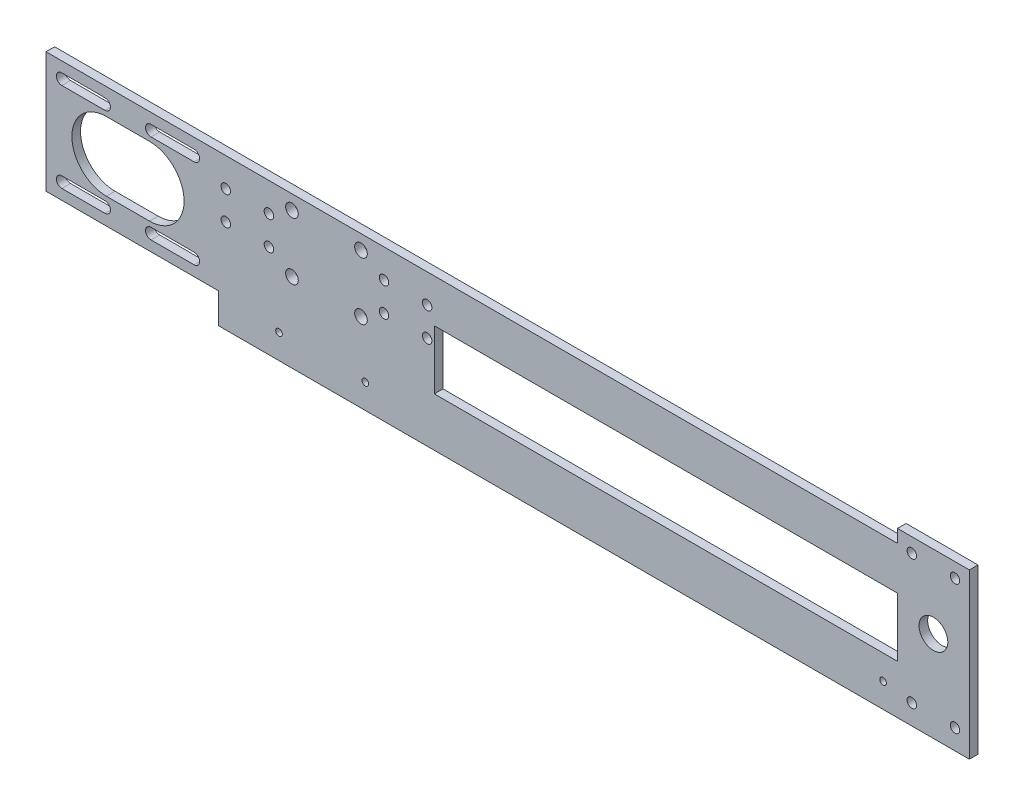
from build123d import *

# Parameters (mm, degrees)
SKETCH_1_W          = 75
SKETCH_1_H          = 30
EXTRUDE_1_DEPTH     = 3
HOLE_WIZARD_1_D     = 4.4
HOLE_WIZARD_2_D     = 3.3
SKETCH_8_W          = 45
SKETCH_8_H          = 42
EXTRUDE_2_DEPTH     = 3
HOLE_WIZARD_3_D     = 3.8
SKETCH_13_W         = 15
SKETCH_13_H         = 42
EXTRUDE_3_DEPTH     = 3
CUT_EXTRUDE_3_DEPTH = 3
CUT_EXTRUDE_5_DEPTH = 3
CUT_EXTRUDE_6_DEPTH = 3
SKETCH_18_W         = 75
SKETCH_18_H         = 2.504084813
SKETCH_18_H_2       = 3
SKETCH_18_W_2       = 161
SKETCH_18_H_3       = 17
EXTRUDE_4_DEPTH     = 3
HOLE_WIZARD_4_D     = 2.3
SKETCH_22_W         = 25
SKETCH_22_H         = 42
EXTRUDE_5_DEPTH     = 3
HOLE_WIZARD_5_D     = 10
HOLE_WIZARD_5_DEPTH = 3
HOLE_WIZARD_7_D     = 3.3
HOLE_WIZARD_7_DEPTH = 3.001
SKETCH_31_W         = 25
SKETCH_31_H         = 15
EXTRUDE_6_DEPTH     = 3
HOLE_WIZARD_8_D     = 3.3
HOLE_WIZARD_8_DEPTH = 3
SKETCH_36_W         = 161
SKETCH_36_H         = 15
EXTRUDE_7_DEPTH     = 3
HOLE_WIZARD_9_D     = 2.3
SKETCH_40_R         = 12
CUT_EXTRUDE_7_DEPTH = 10


with BuildPart() as part:
    # 草图1 → 凸台-拉伸1 (new body)
    with BuildSketch(Plane.XY):
        with Locations((37.5, 15)):
            Rectangle(SKETCH_1_W, SKETCH_1_H)
    extrude(amount=EXTRUDE_1_DEPTH)

    # 孔1 (through all)
    with Locations(Plane.XY.offset(3)):
        with Locations((25.5, 25), (49.5, 25), (49.5, 5), (25.5, 5)):
            Hole(HOLE_WIZARD_1_D / 2)

    # 孔2 (through all)
    with Locations(Plane.XY.offset(3)):
        with Locations((2.5, 20), (17.5, 20), (17.5, 10), (2.5, 10), (57.5, 10), (57.5, 20), (72.5, 20), (72.5, 10)):
            Hole(HOLE_WIZARD_2_D / 2)

    # 草图8 → 凸台-拉伸2 (add)
    with BuildSketch(Plane(origin=(0, 0, 0), x_dir=(-1, 0, 0), z_dir=(0, 0, -1))):
        with Locations((22.5, 9)):
            Rectangle(SKETCH_8_W, SKETCH_8_H)
    extrude(amount=-EXTRUDE_2_DEPTH)

    # 孔3 (through all)
    with Locations(Plane.XY.offset(3)):
        with Locations((-39.5, 24.5), (-8.5, 24.5), (-8.5, -6.5), (-39.5, -6.5)):
            Hole(HOLE_WIZARD_3_D / 2)

    # 草图13 → 凸台-拉伸3 (add)
    with BuildSketch(Plane(origin=(0, 0, 0), x_dir=(-1, 0, 0), z_dir=(0, 0, -1))):
        with Locations((52.5, 9)):
            Rectangle(SKETCH_13_W, SKETCH_13_H)
    extrude(amount=-EXTRUDE_3_DEPTH)

    # 草图14 → 切除-拉伸3 (cut)
    with BuildSketch(Plane(origin=(0, 0, 0), x_dir=(-1, 0, 0), z_dir=(0, 0, -1))):
        with BuildLine():
            Line((23.5, 26.4), (8.5, 26.4))
            ThreePointArc((8.5, 26.4), (9.843502884, 25.843502884), (10.4, 24.5))
            ThreePointArc((10.4, 24.5), (9.843502884, 23.156497116), (8.5, 22.6))
            Line((8.5, 22.6), (23.5, 22.6))
            ThreePointArc((23.5, 22.6), (21.6, 24.5), (23.5, 26.4))
        make_face()
        with BuildLine():
            ThreePointArc((25.4, 24.5), (24.843502884, 25.843502884), (23.5, 26.4))
            Line((23.5, 26.4), (23.5, 22.6))
            ThreePointArc((23.5, 22.6), (24.843502884, 23.156497116), (25.4, 24.5))
        make_face()
        with BuildLine():
            Line((23.5, 22.6), (23.5, 26.4))
            ThreePointArc((23.5, 26.4), (21.6, 24.5), (23.5, 22.6))
        make_face()
        with BuildLine():
            ThreePointArc((10.4, 24.5), (9.843502884, 25.843502884), (8.5, 26.4))
            Line((8.5, 26.4), (8.5, 22.6))
            ThreePointArc((8.5, 22.6), (9.843502884, 23.156497116), (10.4, 24.5))
        make_face()
        with BuildLine():
            Line((8.5, 22.6), (8.5, 26.4))
            ThreePointArc((8.5, 26.4), (6.6, 24.5), (8.5, 22.6))
        make_face()
        with BuildLine():
            Line((23.5, -4.6), (8.5, -4.6))
            ThreePointArc((8.5, -4.6), (9.843502884, -5.156497116), (10.4, -6.5))
            ThreePointArc((10.4, -6.5), (9.843502884, -7.843502884), (8.5, -8.4))
            Line((8.5, -8.4), (23.5, -8.4))
            ThreePointArc((23.5, -8.4), (21.6, -6.5), (23.5, -4.6))
        make_face()
        with BuildLine():
            ThreePointArc((10.4, -6.5), (9.843502884, -5.156497116), (8.5, -4.6))
            Line((8.5, -4.6), (8.5, -8.4))
            ThreePointArc((8.5, -8.4), (9.843502884, -7.843502884), (10.4, -6.5))
        make_face()
        with BuildLine():
            Line((8.5, -8.4), (8.5, -4.6))
            ThreePointArc((8.5, -4.6), (6.6, -6.5), (8.5, -8.4))
        make_face()
        with BuildLine():
            ThreePointArc((25.4, -6.5), (24.843502884, -5.156497116), (23.5, -4.6))
            Line((23.5, -4.6), (23.5, -8.4))
            ThreePointArc((23.5, -8.4), (24.843502884, -7.843502884), (25.4, -6.5))
        make_face()
        with BuildLine():
            Line((23.5, -8.4), (23.5, -4.6))
            ThreePointArc((23.5, -4.6), (21.6, -6.5), (23.5, -8.4))
        make_face()
        with BuildLine():
            ThreePointArc((39.5, 26.4), (40.843502884, 25.843502884), (41.4, 24.5))
            Line((41.4, 24.5), (52.6, 24.5))
            ThreePointArc((52.6, 24.5), (53.156497116, 25.843502884), (54.5, 26.4))
            Line((54.5, 26.4), (39.5, 26.4))
        make_face()
        with BuildLine():
            Line((52.6, 24.5), (41.4, 24.5))
            ThreePointArc((41.4, 24.5), (40.843502884, 23.156497116), (39.5, 22.6))
            Line((39.5, 22.6), (54.5, 22.6))
            ThreePointArc((54.5, 22.6), (53.156497116, 23.156497116), (52.6, 24.5))
        make_face()
        with BuildLine():
            Line((41.4, 24.5), (39.5, 24.5))
            Line((39.5, 24.5), (39.5, 22.6))
            ThreePointArc((39.5, 22.6), (40.843502884, 23.156497116), (41.4, 24.5))
        make_face()
        with BuildLine():
            Line((39.5, 26.4), (39.5, 24.5))
            Line((39.5, 24.5), (41.4, 24.5))
            ThreePointArc((41.4, 24.5), (40.843502884, 25.843502884), (39.5, 26.4))
        make_face()
        with BuildLine():
            Line((39.5, 22.6), (39.5, 24.5))
            Line((39.5, 24.5), (39.5, 26.4))
            ThreePointArc((39.5, 26.4), (37.6, 24.5), (39.5, 22.6))
        make_face()
        with BuildLine():
            Line((54.5, 24.5), (54.5, 22.6))
            ThreePointArc((54.5, 22.6), (55.843502884, 23.156497116), (56.4, 24.5))
            ThreePointArc((56.4, 24.5), (55.843502884, 25.843502884), (54.5, 26.4))
            Line((54.5, 26.4), (54.5, 24.5))
        make_face()
        with BuildLine():
            Line((54.5, 24.5), (52.6, 24.5))
            ThreePointArc((52.6, 24.5), (53.156497116, 23.156497116), (54.5, 22.6))
            Line((54.5, 22.6), (54.5, 24.5))
        make_face()
        with BuildLine():
            ThreePointArc((54.5, 26.4), (53.156497116, 25.843502884), (52.6, 24.5))
            Line((52.6, 24.5), (54.5, 24.5))
            Line((54.5, 24.5), (54.5, 26.4))
        make_face()
        with BuildLine():
            Line((54.5, -4.6), (39.5, -4.6))
            ThreePointArc((39.5, -4.6), (40.843502884, -5.156497116), (41.4, -6.5))
            Line((41.4, -6.5), (52.6, -6.5))
            ThreePointArc((52.6, -6.5), (53.156497116, -5.156497116), (54.5, -4.6))
        make_face()
        with BuildLine():
            Line((52.6, -6.5), (41.4, -6.5))
            ThreePointArc((41.4, -6.5), (40.843502884, -7.843502884), (39.5, -8.4))
            Line((39.5, -8.4), (54.5, -8.4))
            ThreePointArc((54.5, -8.4), (53.156497116, -7.843502884), (52.6, -6.5))
        make_face()
        with BuildLine():
            Line((54.5, -6.5), (54.5, -4.6))
            ThreePointArc((54.5, -4.6), (53.156497116, -5.156497116), (52.6, -6.5))
            Line((52.6, -6.5), (54.5, -6.5))
        make_face()
        with BuildLine():
            Line((54.5, -8.4), (54.5, -6.5))
            Line((54.5, -6.5), (52.6, -6.5))
            ThreePointArc((52.6, -6.5), (53.156497116, -7.843502884), (54.5, -8.4))
        make_face()
        with BuildLine():
            ThreePointArc((56.4, -6.5), (55.843502884, -5.156497116), (54.5, -4.6))
            Line((54.5, -4.6), (54.5, -6.5))
            Line((54.5, -6.5), (54.5, -8.4))
            ThreePointArc((54.5, -8.4), (55.843502884, -7.843502884), (56.4, -6.5))
        make_face()
        with BuildLine():
            ThreePointArc((41.4, -6.5), (40.843502884, -5.156497116), (39.5, -4.6))
            Line((39.5, -4.6), (39.5, -6.5))
            Line((39.5, -6.5), (41.4, -6.5))
        make_face()
        with BuildLine():
            Line((41.4, -6.5), (39.5, -6.5))
            Line((39.5, -6.5), (39.5, -8.4))
            ThreePointArc((39.5, -8.4), (40.843502884, -7.843502884), (41.4, -6.5))
        make_face()
        with BuildLine():
            Line((39.5, -6.5), (39.5, -4.6))
            ThreePointArc((39.5, -4.6), (37.6, -6.5), (39.5, -8.4))
            Line((39.5, -8.4), (39.5, -6.5))
        make_face()
    extrude(amount=-CUT_EXTRUDE_3_DEPTH, mode=Mode.SUBTRACT)

    # 草图16 → 切除-拉伸5 (cut)
    with BuildSketch(Plane(origin=(0, 0, 0), x_dir=(-1, 0, 0), z_dir=(0, 0, -1))):
        with BuildLine():
            Line((24, 20.504084813), (24, -2.489125293))
            Line((24, -2.489125293), (39.5, -2.489125293))
            ThreePointArc((39.5, -2.489125293), (50.5, 9), (39.5, 20.489125293))
            Line((39.5, 20.489125293), (39.5, 20.504084813))
            Line((39.5, 20.504084813), (24, 20.504084813))
        make_face()
    extrude(amount=-CUT_EXTRUDE_5_DEPTH, mode=Mode.SUBTRACT)

    # 草图17 → 切除-拉伸6 (cut)
    with BuildSketch(Plane(origin=(0, 0, 0), x_dir=(-1, 0, 0), z_dir=(0, 0, -1))):
        with BuildLine():
            Line((24, -2.489125293), (24, 20.504084813))
            ThreePointArc((24, 20.504084813), (12.495915187, 9), (24, -2.504084813))
            Line((24, -2.504084813), (24, -2.489125293))
        make_face()
    extrude(amount=-CUT_EXTRUDE_6_DEPTH, mode=Mode.SUBTRACT)

    # 草图18 → 凸台-拉伸4 (add)
    with BuildSketch(Plane(origin=(0, 0, 0), x_dir=(-1, 0, 0), z_dir=(0, 0, -1))):
        with Locations((-37.5, -1.252042406)):
            Rectangle(SKETCH_18_W, SKETCH_18_H)
        with Locations((-37.5, -4.004084813)):
            Rectangle(SKETCH_18_W, SKETCH_18_H_2)
        Polygon((0, -12), (0, -5.504084813), (-75, -5.504084813), (-75, -22.504084813), (0, -22.504084813), align=None)
        with Locations((-155.5, -14.004084813)):
            Rectangle(SKETCH_18_W_2, SKETCH_18_H_3)
    extrude(amount=-EXTRUDE_4_DEPTH)

    # 孔4 (through all)
    with Locations(Plane.XY.offset(3)):
        with Locations((51, -14.004084813), (231, -14.004084813)):
            Hole(HOLE_WIZARD_4_D / 2)

    # 草图22 → 凸台-拉伸5 (add)
    with BuildSketch(Plane(origin=(0, 0, 0), x_dir=(-1, 0, 0), z_dir=(0, 0, -1))):
        with Locations((-248.5, -1.504084813)):
            Rectangle(SKETCH_22_W, SKETCH_22_H)
    extrude(amount=-EXTRUDE_5_DEPTH)

    # 孔5
    with Locations(Plane(origin=(0, 0, 0), x_dir=(-1, 0, 0), z_dir=(0, 0, -1))):
        with Locations((-248.5, 8.995915187), (-277.5, 6.995915187)):
            Hole(HOLE_WIZARD_5_D / 2, depth=HOLE_WIZARD_5_DEPTH)

    # 孔7
    with Locations(Plane(origin=(0, 0, 0), x_dir=(-1, 0, 0), z_dir=(0, 0, -1))):
        with Locations((-241, -15.504084813), (-285, -15.504084813), (-270, -15.504084813), (-256, -15.504084813)):
            Hole(HOLE_WIZARD_7_D / 2, depth=HOLE_WIZARD_7_DEPTH)

    # 草图31 → 凸台-拉伸6 (add)
    with BuildSketch(Plane(origin=(0, 0, 0), x_dir=(-1, 0, 0), z_dir=(0, 0, -1))):
        with Locations((-248.5, 26.995915187)):
            Rectangle(SKETCH_31_W, SKETCH_31_H)
    extrude(amount=-EXTRUDE_6_DEPTH)

    # 孔8
    with Locations(Plane(origin=(0, 0, 0), x_dir=(-1, 0, 0), z_dir=(0, 0, -1))):
        with Locations((-241, 29.495915187), (-285, 29.495915187), (-270, 29.495915187), (-256, 29.495915187)):
            Hole(HOLE_WIZARD_8_D / 2, depth=HOLE_WIZARD_8_DEPTH)

    # 草图36 → 凸台-拉伸7 (add)
    with BuildSketch(Plane(origin=(0, 0, 0), x_dir=(-1, 0, 0), z_dir=(0, 0, -1))):
        with Locations((-155.5, 22.5)):
            Rectangle(SKETCH_36_W, SKETCH_36_H)
    extrude(amount=-EXTRUDE_7_DEPTH)

    # 孔9 (through all)
    with Locations(Plane(origin=(0, 0, 0), x_dir=(-1, 0, 0), z_dir=(0, 0, -1))):
        with Locations((-21, -14.004084813)):
            Hole(HOLE_WIZARD_9_D / 2)

    # 草图40 → 切除-拉伸7 (cut)
    with BuildSketch(Plane(origin=(0, 0, 0), x_dir=(-1, 0, 0), z_dir=(0, 0, -1))):
        with Locations((39, 9)):
            Circle(SKETCH_40_R)
        with Locations((24, 9)):
            Circle(SKETCH_40_R)
        with BuildLine():
            Line((39, 21), (24, 21))
            ThreePointArc((24, 21), (27.974294656, 20.322763885), (31.5, 18.367496998))
            ThreePointArc((31.5, 18.367496998), (35.025705344, 20.322763885), (39, 21))
        make_face()
        with BuildLine():
            ThreePointArc((31.5, -0.367496998), (27.974294656, -2.322763885), (24, -3))
            Line((24, -3), (39, -3))
            ThreePointArc((39, -3), (35.025705344, -2.322763885), (31.5, -0.367496998))
        make_face()
    extrude(amount=-CUT_EXTRUDE_7_DEPTH, mode=Mode.SUBTRACT)


solid = part.part
